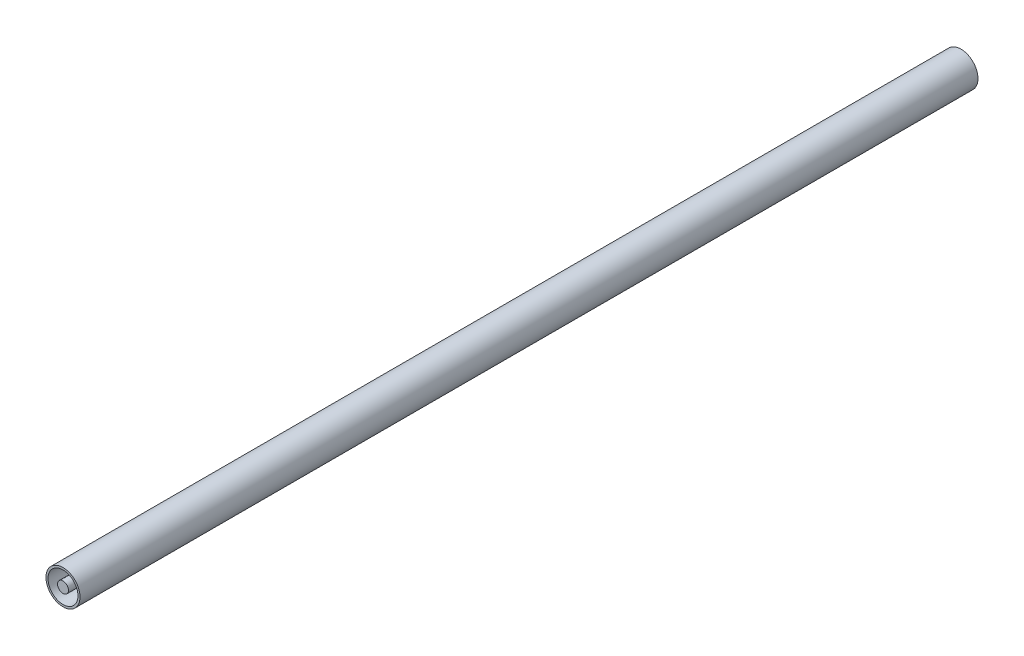
from build123d import *

# Parameters (mm, degrees)
EXTRUDE_START        = -350
EXTRUDE_SKETCH_1_R   = 12.5
EXTRUDE_SKETCH_1_R_2 = 11
EXTRUDE_1_DEPTH      = 659
EXTRUDE_START_2      = -351
EXTRUDE_SKETCH_2_R   = 4
EXTRUDE_2_DEPTH      = 660


with BuildPart() as part:
    # Extrude sketch 1 → Extrude 1 (new body)
    with BuildSketch(Plane.XY.offset(EXTRUDE_START)):
        with Locations((240, 0)):
            Circle(EXTRUDE_SKETCH_1_R)
        with Locations((240, 0)):
            Circle(EXTRUDE_SKETCH_1_R_2, mode=Mode.SUBTRACT)
    extrude(amount=EXTRUDE_1_DEPTH)


with BuildPart() as body_2:
    # Extrude sketch 2 → Extrude 2 (new body)
    with BuildSketch(Plane.XY.offset(EXTRUDE_START_2)):
        with Locations((240, 0)):
            Circle(EXTRUDE_SKETCH_2_R)
    extrude(amount=EXTRUDE_2_DEPTH)


solid = Compound([part.part, body_2.part])
